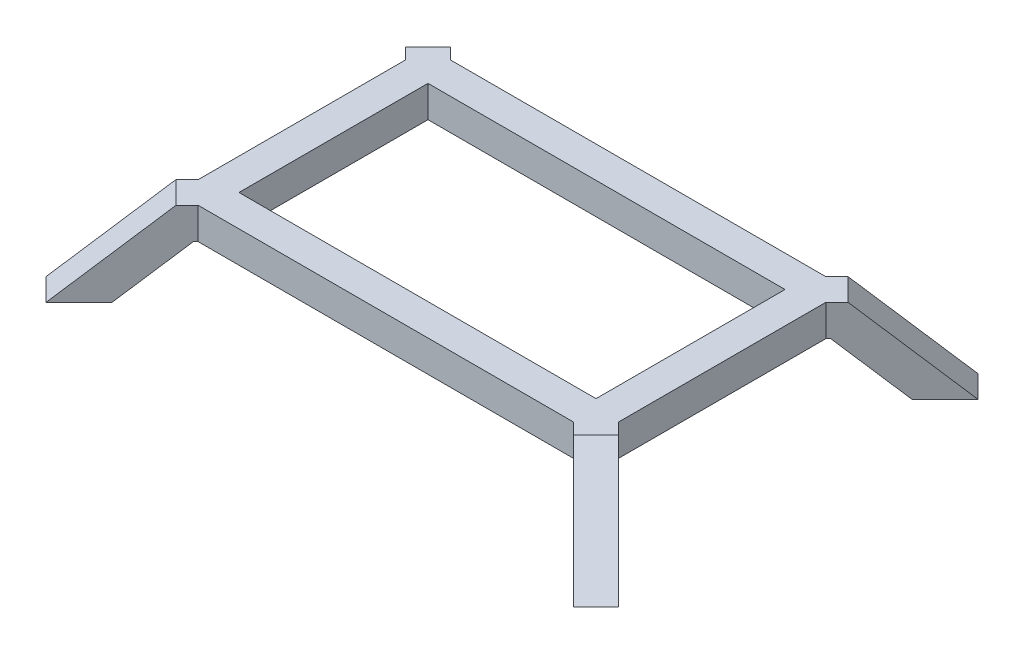
from build123d import *

# Parameters (mm, degrees)
SKETCH1_W            = 508
SKETCH1_H            = 304.8
SKETCH1_W_2          = 431.8
SKETCH1_H_2          = 228.6
BOSS_EXTRUDE1_DEPTH  = 38.1
BOSS_EXTRUDE3_DEPTH  = 19.05
MIRROR3_COPY_1_DEPTH = 19.05


with BuildPart() as part:
    # Sketch1 → Boss-Extrude1 (new body)
    with BuildSketch(Plane(origin=(0, 0, 0), x_dir=(1, 0, 0), z_dir=(0, 1, 0))):
        Rectangle(SKETCH1_W, SKETCH1_H)
        Rectangle(SKETCH1_W_2, SKETCH1_H_2, mode=Mode.SUBTRACT)
    extrude(amount=BOSS_EXTRUDE1_DEPTH)

    # Sketch3 → Boss-Extrude3 (add, symmetric)
    with BuildSketch(Plane(origin=(-50.8, 0, -50.8), x_dir=(0.7071067811865475, 0, -0.7071067811865477), z_dir=(0.7071067811865477, 0, 0.7071067811865475))):
        Polygon((-287.368195874, 38.1), (-398.488889778, -63.5), (-342.026330623, -63.5), (-272.575896933, 0), (-266.942696668, 0), (-266.942696668, 38.1), align=None)
    boss_extrude3 = extrude(amount=BOSS_EXTRUDE3_DEPTH, both=True)

    # Mirror2: Boss-Extrude3 across plane
    add(boss_extrude3.mirror(Plane(origin=(0, 0, 0), x_dir=(0, 0, 1), z_dir=(1, 0, 0))))

    # Mirror3: Boss-Extrude3 across plane
    add(boss_extrude3.mirror(Plane.XY))

    # Mirror3 copy 1 sketch → Mirror3 copy 1 (add, symmetric)
    with BuildSketch(Plane(origin=(50.8, 0, 50.8), x_dir=(-0.7071067811865475, 0, 0.7071067811865477), z_dir=(-0.7071067811865477, 0, -0.7071067811865475))):
        Polygon((-287.368195874, 38.1), (-398.488889778, -63.5), (-342.026330623, -63.5), (-272.575896933, 0), (-266.942696668, 0), (-266.942696668, 38.1), align=None)
    extrude(amount=MIRROR3_COPY_1_DEPTH, both=True)


solid = part.part
